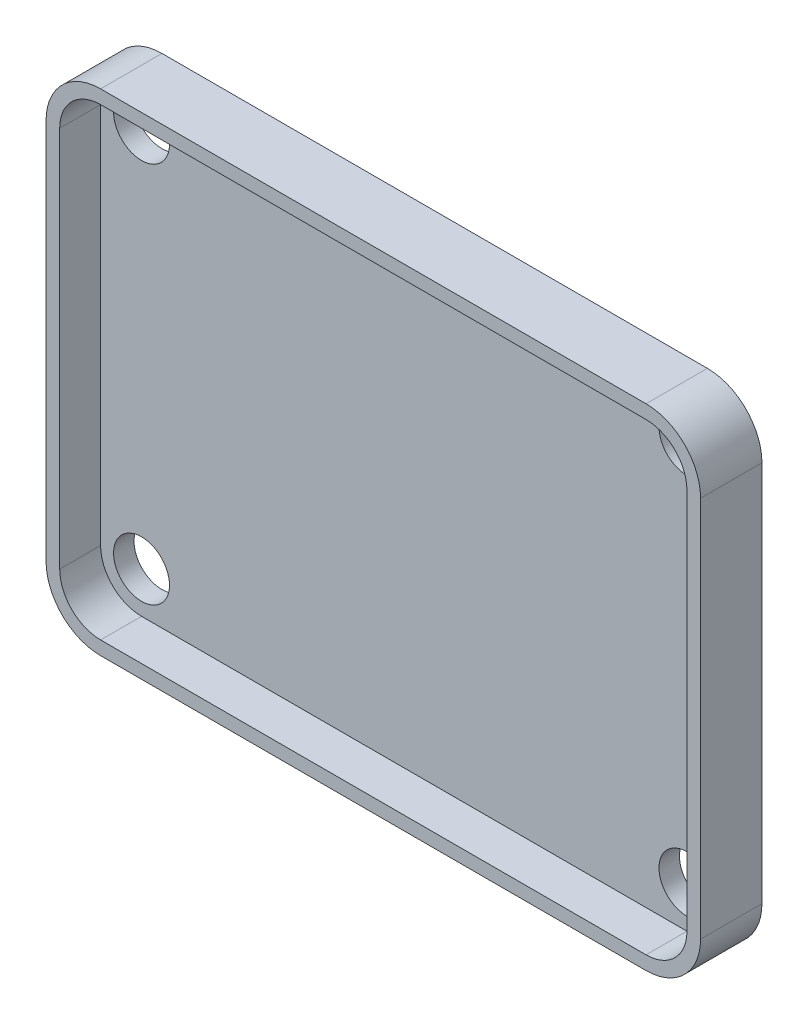
from build123d import *

# Parameters (mm, degrees)
SKETCH1_R           = 2.05
BOSS_EXTRUDE1_DEPTH = 2.25
CUT_EXTRUDE2_DEPTH  = 3


with BuildPart() as part:
    # Sketch1 → Boss-Extrude1 (new, symmetric)
    with BuildSketch(Plane.XY):
        with BuildLine():
            Line((-20, -18), (20, -18))
            ThreePointArc((20, -18), (22.828427125, -16.828427125), (24, -14))
            Line((24, -14), (24, 14))
            ThreePointArc((24, 14), (22.828427125, 16.828427125), (20, 18))
            Line((20, 18), (-20, 18))
            ThreePointArc((-20, 18), (-22.828427125, 16.828427125), (-24, 14))
            Line((-24, 14), (-24, -14))
            ThreePointArc((-24, -14), (-22.828427125, -16.828427125), (-20, -18))
        make_face()
        with Locations((-20, -14)):
            Circle(SKETCH1_R, mode=Mode.SUBTRACT)
        with Locations((-20, 14)):
            Circle(SKETCH1_R, mode=Mode.SUBTRACT)
        with Locations((20, 14)):
            Circle(SKETCH1_R, mode=Mode.SUBTRACT)
        with Locations((20, -14)):
            Circle(SKETCH1_R, mode=Mode.SUBTRACT)
    extrude(amount=BOSS_EXTRUDE1_DEPTH, both=True)

    # Sketch3 → Cut-Extrude2 (cut)
    with BuildSketch(Plane.XY.offset(2.25)):
        with BuildLine():
            Line((23, -14), (23, 14))
            ThreePointArc((23, 14), (22.121320344, 16.121320344), (20, 17))
            Line((20, 17), (-20, 17))
            ThreePointArc((-20, 17), (-22.121320344, 16.121320344), (-23, 14))
            Line((-23, 14), (-23, -14))
            ThreePointArc((-23, -14), (-22.121320344, -16.121320344), (-20, -17))
            Line((-20, -17), (20, -17))
            ThreePointArc((20, -17), (22.121320344, -16.121320344), (23, -14))
        make_face()
    extrude(amount=-CUT_EXTRUDE2_DEPTH, mode=Mode.SUBTRACT)


solid = part.part
